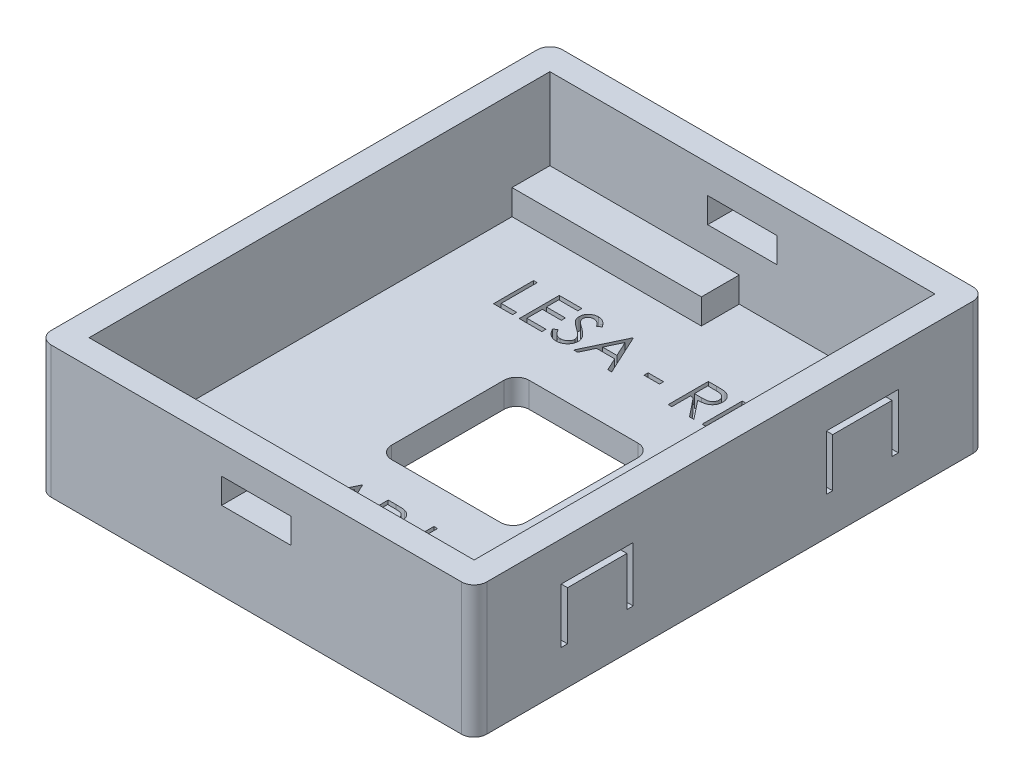
from build123d import *

# Parameters (mm, degrees)
SKETCH1_W           = 34.5
SKETCH1_H           = 40.5
BOSS_EXTRUDE1_DEPTH = 10.45
SKETCH4_W           = 30.5
SKETCH4_H           = 36.5
CUT_EXTRUDE2_DEPTH  = 8.45
SKETCH7_W           = 3
SKETCH7_H           = 3
SKETCH7_W_2         = 2
SKETCH7_W_3         = 15
SKETCH7_W_4         = 10
BOSS_EXTRUDE2_DEPTH = 2
CUT_EXTRUDE3_DEPTH  = 2
CUT_EXTRUDE4_DEPTH  = 2
SKETCH11_W          = 4.7
SKETCH11_H          = 3.85
CUT_EXTRUDE5_DEPTH  = 0.6
FILLET1_R           = 1
FILLET2_R           = 1
FILLET3_R           = 1
FILLET4_R           = 1
SKETCH13_W          = 1.221153846
SKETCH13_H          = 0.325641026
SKETCH13_W_2        = 0.284935898
SKETCH13_H_2        = 3.175
CUT_EXTRUDE6_DEPTH  = 1
SKETCH14_W          = 5.5
SKETCH14_H          = 2
CUT_EXTRUDE7_DEPTH  = 40.5


with BuildPart() as part:
    # Sketch1 → Boss-Extrude1 (new body)
    with BuildSketch(Plane(origin=(0, 0, 0), x_dir=(1, 0, 0), z_dir=(0, 1, 0))):
        Rectangle(SKETCH1_W, SKETCH1_H)
    extrude(amount=BOSS_EXTRUDE1_DEPTH)

    # Sketch4 → Cut-Extrude2 (cut)
    with BuildSketch(Plane(origin=(0, 10.45, 0), x_dir=(1, 0, 0), z_dir=(0, 1, 0))):
        Rectangle(SKETCH4_W, SKETCH4_H)
    extrude(amount=-CUT_EXTRUDE2_DEPTH, mode=Mode.SUBTRACT)

    # Sketch7 → Boss-Extrude2 (add)
    with BuildSketch(Plane(origin=(0, 2, 0), x_dir=(1, 0, 0), z_dir=(0, 1, 0))):
        with Locations((13.75, -16.75)):
            Rectangle(SKETCH7_W, SKETCH7_H)
        with Locations((14.25, 16.75)):
            Rectangle(SKETCH7_W_2, SKETCH7_H)
        with Locations((-7.75, 16.75)):
            Rectangle(SKETCH7_W_3, SKETCH7_H)
        with Locations((-10.25, -16.75)):
            Rectangle(SKETCH7_W_4, SKETCH7_H)
    extrude(amount=BOSS_EXTRUDE2_DEPTH)

    # Sketch8 → Cut-Extrude3 (cut)
    with BuildSketch(Plane(origin=(0, 2, 0), x_dir=(1, 0, 0), z_dir=(0, 1, 0))):
        with BuildLine():
            Line((-3.35, -6.18), (5.27, -6.18))
            ThreePointArc((5.27, -6.18), (5.977106781, -5.887106781), (6.27, -5.18))
            Line((6.27, -5.18), (6.27, 3.71))
            ThreePointArc((6.27, 3.71), (5.977106781, 4.417106781), (5.27, 4.71))
            Line((5.27, 4.71), (-3.35, 4.71))
            ThreePointArc((-3.35, 4.71), (-4.057106781, 4.417106781), (-4.35, 3.71))
            Line((-4.35, 3.71), (-4.35, -5.18))
            ThreePointArc((-4.35, -5.18), (-4.057106781, -5.887106781), (-3.35, -6.18))
        make_face()
    extrude(amount=-CUT_EXTRUDE3_DEPTH, mode=Mode.SUBTRACT)

    # Sketch10 → Cut-Extrude4 (cut)
    with BuildSketch(Plane.ZY.offset(-15.25)):
        Polygon((-13.35, 3), (-13.35, 7.35), (-7.65, 7.35), (-7.65, 3), (-8.15, 3), (-8.15, 6.85), (-12.85, 6.85), (-12.85, 3), align=None)
        Polygon((7.65, 3), (7.65, 7.35), (13.35, 7.35), (13.35, 3), (12.85, 3), (12.85, 6.85), (8.15, 6.85), (8.15, 3), align=None)
    extrude(amount=-CUT_EXTRUDE4_DEPTH, mode=Mode.SUBTRACT)

    # Sketch11 → Cut-Extrude5 (cut)
    with BuildSketch(Plane.ZY.offset(-15.25)):
        with Locations((-10.5, 4.925)):
            Rectangle(SKETCH11_W, SKETCH11_H)
        with Locations((10.5, 4.925)):
            Rectangle(SKETCH11_W, SKETCH11_H)
    extrude(amount=-CUT_EXTRUDE5_DEPTH, mode=Mode.SUBTRACT)

    # Fillet1
    fillet1_edges = [part.edges().sort_by_distance(p)[0] for p in [
        (17.25, 5.225, 20.25),
    ]]
    fillet(fillet1_edges, radius=FILLET1_R)

    # Fillet2
    fillet2_edges = [part.edges().sort_by_distance(p)[0] for p in [
        (17.25, 5.225, -20.25),
    ]]
    fillet(fillet2_edges, radius=FILLET2_R)

    # Fillet3
    fillet3_edges = [part.edges().sort_by_distance(p)[0] for p in [
        (-17.25, 5.225, -20.25),
    ]]
    fillet(fillet3_edges, radius=FILLET3_R)

    # Fillet4
    fillet4_edges = [part.edges().sort_by_distance(p)[0] for p in [
        (-17.25, 5.225, 20.25),
    ]]
    fillet(fillet4_edges, radius=FILLET4_R)

    # Sketch13 → Cut-Extrude6 (cut)
    # profile 1 of 11: a face of its own
    with BuildSketch(Plane(origin=(0, 2, 0), x_dir=(1, 0, 0), z_dir=(0, 1, 0))):
        Polygon((-10.014375407, 11.723911499), (-9.72943951, 11.723911499), (-9.72943951, 8.874552525), (-8.508285664, 8.874552525), (-8.508285664, 8.548911499), (-10.014375407, 8.548911499), align=None)
    # profile 2 of 11: a face of its own
    with BuildSketch(Plane(origin=(0, 2, 0), x_dir=(1, 0, 0), z_dir=(0, 1, 0))):
        Polygon((-7.979118997, 11.723911499), (-6.188093356, 11.723911499), (-6.188093356, 11.398270473), (-7.694183099, 11.398270473), (-7.694183099, 10.421347396), (-6.188093356, 10.421347396), (-6.188093356, 10.095706371), (-7.694183099, 10.095706371), (-7.694183099, 8.874552525), (-6.188093356, 8.874552525), (-6.188093356, 8.548911499), (-7.979118997, 8.548911499), align=None)
    # profile 3 of 11: a face of its own
    with BuildSketch(Plane(origin=(0, 2, 0), x_dir=(1, 0, 0), z_dir=(0, 1, 0))):
        with BuildLine():
            Line((-5.943862587, 9.161396475), (-5.675463148, 9.322308935))
            add(Edge.make_bspline(
                [(-5.675463148, 9.322308935), (-5.650500175, 9.280521957), (-5.602672083, 9.20045972), (-5.522887636, 9.092275641), (-5.440217067, 9.000325684), (-5.354048171, 8.925144762), (-5.264906918, 8.8659547), (-5.172211384, 8.824042676), (-5.076273941, 8.797902469), (-5.010983403, 8.794727391), (-4.978387827, 8.793142268)],
                knots=[0, 0, 0, 0, 1.272034388, 2.437168799, 3.508375237, 4.49857839, 5.41946034, 6.295179144, 7.148887113, 8, 8, 8, 8], degree=3))
            add(Edge.make_bspline(
                [(-4.978387827, 8.793142268), (-4.950550461, 8.793917578), (-4.895362817, 8.795454632), (-4.814117068, 8.810223645), (-4.735212147, 8.83291322), (-4.660274311, 8.865407922), (-4.590337575, 8.904722119), (-4.529008645, 8.952207581), (-4.47598967, 9.005371781), (-4.432619974, 9.06468319), (-4.399345942, 9.128470889), (-4.373771708, 9.193944787), (-4.359579391, 9.262133417), (-4.357441479, 9.308044337), (-4.356362587, 9.331213182)],
                knots=[0, 0, 0, 0, 1.095163259, 2.171163733, 3.241058638, 4.321873601, 5.38011039, 6.391990106, 7.366004449, 8.327778327, 9.272591725, 10.192022065, 11.087607919, 12, 12, 12, 12], degree=3))
            add(Edge.make_bspline(
                [(-4.356362587, 9.331213182), (-4.357699997, 9.357648095), (-4.360418757, 9.411386412), (-4.383398028, 9.490670383), (-4.419546988, 9.5691315), (-4.452895958, 9.617664791), (-4.470209742, 9.642861819)],
                knots=[0, 0, 0, 0, 0.938893495, 1.908633276, 2.914225137, 4, 4, 4, 4], degree=3))
            add(Edge.make_bspline(
                [(-4.470209742, 9.642861819), (-4.484425228, 9.661047152), (-4.514268862, 9.699224984), (-4.565574605, 9.756053162), (-4.625778152, 9.814671299), (-4.692819234, 9.877317729), (-4.769139965, 9.941078802), (-4.852349924, 10.008995025), (-4.944573568, 10.078483599), (-5.009252397, 10.125085855), (-5.042625607, 10.149131851)],
                knots=[0, 0, 0, 0, 0.722233717, 1.516239348, 2.393582979, 3.351407094, 4.387010283, 5.505090956, 6.712668013, 8, 8, 8, 8], degree=3))
            add(Edge.make_bspline(
                [(-5.042625607, 10.149131851), (-5.076030233, 10.172924927), (-5.139897332, 10.218415477), (-5.229213332, 10.285928934), (-5.309082237, 10.347654445), (-5.37914906, 10.404173084), (-5.43938298, 10.455492518), (-5.490258645, 10.501119935), (-5.530480051, 10.542289308), (-5.552846185, 10.568996811), (-5.562888027, 10.580987821)],
                knots=[0, 0, 0, 0, 1.452282411, 2.77665338, 3.964542531, 5.026858415, 5.96415736, 6.766646006, 7.446254459, 8, 8, 8, 8], degree=3))
            add(Edge.make_bspline(
                [(-5.562888027, 10.580987821), (-5.576923836, 10.599675904), (-5.604527138, 10.636428529), (-5.640963443, 10.693873221), (-5.671932541, 10.752677183), (-5.696209799, 10.812998432), (-5.716653369, 10.873990117), (-5.730403778, 10.936448033), (-5.739013831, 11.000091923), (-5.739895561, 11.042921312), (-5.740336946, 11.064361218)],
                knots=[0, 0, 0, 0, 1.068054152, 2.10047183, 3.106115577, 4.101338837, 5.06977816, 6.043150881, 7.020423561, 8, 8, 8, 8], degree=3))
            add(Edge.make_bspline(
                [(-5.740336946, 11.064361218), (-5.739152935, 11.097952514), (-5.73681022, 11.164417115), (-5.716997751, 11.261509368), (-5.685725912, 11.354207046), (-5.641915549, 11.441592421), (-5.585439236, 11.521390132), (-5.520083245, 11.594518081), (-5.442239968, 11.655993866), (-5.356830088, 11.709707662), (-5.263343237, 11.751750037), (-5.16538006, 11.78346464), (-5.062784859, 11.801434467), (-4.993294872, 11.804013261), (-4.958035263, 11.805321755)],
                knots=[0, 0, 0, 0, 1.005424448, 1.989358655, 2.955360095, 3.929531133, 4.905563448, 5.876582895, 6.856512386, 7.866279853, 8.892233794, 9.918561126, 10.94386622, 12, 12, 12, 12], degree=3))
            add(Edge.make_bspline(
                [(-4.958035263, 11.805321755), (-4.920620972, 11.804031298), (-4.846215889, 11.80146499), (-4.736769814, 11.779151515), (-4.63139545, 11.742230191), (-4.54662906, 11.70033048), (-4.480287198, 11.658482696), (-4.429693362, 11.620364712), (-4.37842396, 11.576481578), (-4.326065439, 11.526716405), (-4.273504983, 11.470612566), (-4.21996228, 11.408554298), (-4.165312122, 11.340920851), (-4.130155021, 11.292638626), (-4.112131817, 11.267886859)],
                knots=[0, 0, 0, 0, 1.286793592, 2.559021753, 3.825965368, 5.121522368, 5.803751409, 6.523245864, 7.299691795, 8.125521123, 9.008227632, 9.944561021, 10.946284179, 12, 12, 12, 12], degree=3))
            Line((-4.112131817, 11.267886859), (-4.369718957, 11.072629448))
            add(Edge.make_bspline(
                [(-4.369718957, 11.072629448), (-4.385272767, 11.092667045), (-4.415225769, 11.131254774), (-4.460700375, 11.185294467), (-4.503561648, 11.234657988), (-4.545789511, 11.277534211), (-4.585153734, 11.316271146), (-4.623359908, 11.349436069), (-4.659858212, 11.37735393), (-4.705865695, 11.407147731), (-4.763666768, 11.436681131), (-4.836224169, 11.46167208), (-4.912048861, 11.476689886), (-4.96369217, 11.47867552), (-4.989836144, 11.47968073)],
                knots=[0, 0, 0, 0, 1.181633172, 2.275549214, 3.290209073, 4.226197932, 5.078386478, 5.862611352, 6.581680152, 7.217281963, 8.414376989, 9.595101626, 10.782541182, 12, 12, 12, 12], degree=3))
            add(Edge.make_bspline(
                [(-4.989836144, 11.47968073), (-5.022635275, 11.478581545), (-5.08588531, 11.47646187), (-5.175683595, 11.453311598), (-5.256504513, 11.41686091), (-5.325948626, 11.36577518), (-5.383767169, 11.305249708), (-5.425591407, 11.235600318), (-5.45076477, 11.158690567), (-5.45383661, 11.105040636), (-5.455401048, 11.077717589)],
                knots=[0, 0, 0, 0, 1.14458467, 2.207223713, 3.21896685, 4.227309161, 5.202851033, 6.127160689, 7.046193047, 8, 8, 8, 8], degree=3))
            add(Edge.make_bspline(
                [(-5.455401048, 11.077717589), (-5.455044426, 11.060707319), (-5.454330599, 11.026658964), (-5.44437489, 10.976356603), (-5.431584784, 10.926181316), (-5.411316825, 10.876358687), (-5.383335728, 10.826017376), (-5.346591747, 10.774290514), (-5.300315386, 10.720722178), (-5.264866953, 10.685881204), (-5.246151249, 10.667486218)],
                knots=[0, 0, 0, 0, 0.858281714, 1.717966888, 2.583508476, 3.4729293, 4.427298488, 5.488583878, 6.674047936, 8, 8, 8, 8], degree=3))
            add(Edge.make_bspline(
                [(-5.246151249, 10.667486218), (-5.239201289, 10.661284059), (-5.222689777, 10.646549149), (-5.192503759, 10.622426151), (-5.152641363, 10.592669351), (-5.104143509, 10.555850857), (-5.046115974, 10.513141245), (-4.978552376, 10.465086611), (-4.902205843, 10.410126944), (-4.848029534, 10.371702604), (-4.81938342, 10.351385457)],
                knots=[0, 0, 0, 0, 0.420754252, 0.999615792, 1.744751191, 2.668019286, 3.750313428, 4.999500688, 6.413464383, 8, 8, 8, 8], degree=3))
            add(Edge.make_bspline(
                [(-4.81938342, 10.351385457), (-4.78492477, 10.326310795), (-4.71820037, 10.277757188), (-4.623260994, 10.204808678), (-4.537178754, 10.133463917), (-4.459651419, 10.064178516), (-4.389913081, 9.997478032), (-4.328737434, 9.932560004), (-4.275501139, 9.86988952), (-4.218188562, 9.789541541), (-4.159625397, 9.690861557), (-4.10933203, 9.569959155), (-4.077619814, 9.448586778), (-4.073472797, 9.367010291), (-4.071426689, 9.326761058)],
                knots=[0, 0, 0, 0, 1.163667725, 2.253281268, 3.268753668, 4.215851969, 5.092017293, 5.902905408, 6.650798638, 7.335211899, 8.59617414, 9.77448103, 10.901945474, 12, 12, 12, 12], degree=3))
            add(Edge.make_bspline(
                [(-4.071426689, 9.326761058), (-4.072022807, 9.298296398), (-4.073203467, 9.241919843), (-4.086775154, 9.159138452), (-4.106659421, 9.078737592), (-4.136628912, 9.001711083), (-4.173207777, 8.926649762), (-4.219622873, 8.855522595), (-4.273423416, 8.786755362), (-4.33513976, 8.722181767), (-4.402672828, 8.662903432), (-4.47405018, 8.610172069), (-4.549388642, 8.566204375), (-4.628279515, 8.530326112), (-4.71074092, 8.502264992), (-4.796745124, 8.481933318), (-4.886433895, 8.469454923), (-4.947394332, 8.468159739), (-4.978387827, 8.467501242)],
                knots=[0, 0, 0, 0, 0.983748083, 1.948392443, 2.894712957, 3.844097841, 4.80183111, 5.778335162, 6.776009319, 7.81870978, 8.863265674, 9.881300176, 10.883814829, 11.87499822, 12.874611388, 13.892143829, 14.928324115, 16, 16, 16, 16], degree=3))
            add(Edge.make_bspline(
                [(-4.978387827, 8.467501242), (-5.00236846, 8.467964957), (-5.050027713, 8.468886547), (-5.120521315, 8.477033851), (-5.189590799, 8.488561009), (-5.256369469, 8.506861773), (-5.321717693, 8.529065888), (-5.385351256, 8.556405661), (-5.447300997, 8.589169122), (-5.50791409, 8.626629609), (-5.567036377, 8.670224848), (-5.624113323, 8.721000806), (-5.681017656, 8.777557085), (-5.736069794, 8.841429525), (-5.790383289, 8.911586215), (-5.842887275, 8.988683545), (-5.894668547, 9.072301573), (-5.927158293, 9.131143472), (-5.943862587, 9.161396475)],
                knots=[0, 0, 0, 0, 0.915332311, 1.819136955, 2.706846663, 3.586547465, 4.459518054, 5.340707479, 6.227863349, 7.133153174, 8.059268498, 9.028702269, 10.047606654, 11.120612155, 12.245963614, 13.433783089, 14.680604001, 16, 16, 16, 16], degree=3))
        make_face()
    # profile 4 of 11: a face of its own
    with BuildSketch(Plane(origin=(0, 2, 0), x_dir=(1, 0, 0), z_dir=(0, 1, 0))):
        Polygon((-2.117580535, 11.723911499), (-0.65219592, 8.548911499), (-0.961936505, 8.548911499), (-1.431317515, 9.566539704), (-2.870625407, 9.566539704), (-3.353362787, 8.548911499), (-3.664375407, 8.548911499), (-2.158285664, 11.723911499), align=None)
        Polygon((-2.141113188, 11.105066347), (-2.716073124, 9.89218073), (-1.581417675, 9.89218073), align=None, mode=Mode.SUBTRACT)
    # profile 5 of 11: a face of its own
    with BuildSketch(Plane(origin=(0, 2, 0), x_dir=(1, 0, 0), z_dir=(0, 1, 0))):
        with Locations((1.464470747, 9.770065345)):
            Rectangle(SKETCH13_W, SKETCH13_H)
    # profile 6 of 11: a face of its own
    with BuildSketch(Plane(origin=(0, 2, 0), x_dir=(1, 0, 0), z_dir=(0, 1, 0))):
        with BuildLine():
            Line((3.825368183, 11.723911499), (4.460749793, 11.723911499))
            add(Edge.make_bspline(
                [(4.460749793, 11.723911499), (4.503150674, 11.72377036), (4.584565062, 11.723499358), (4.701199386, 11.721988273), (4.807178253, 11.717657251), (4.90244625, 11.713930178), (4.98700163, 11.707133917), (5.061103672, 11.700638187), (5.124411083, 11.692134938), (5.162734105, 11.684237876), (5.180085731, 11.6806623)],
                knots=[0, 0, 0, 0, 1.410062039, 2.707475311, 3.878576406, 4.937260626, 5.877586885, 6.699081471, 7.410979367, 8, 8, 8, 8], degree=3))
            add(Edge.make_bspline(
                [(5.180085731, 11.6806623), (5.203314597, 11.67492302), (5.249276794, 11.663566895), (5.315452926, 11.639564257), (5.378512348, 11.611787883), (5.438193117, 11.579163651), (5.494196299, 11.541449386), (5.547099339, 11.499296161), (5.597142295, 11.452934624), (5.642301345, 11.401195875), (5.68488177, 11.346915613), (5.72079431, 11.288220062), (5.751751902, 11.226841391), (5.776399443, 11.162155376), (5.79624589, 11.09478934), (5.810239693, 11.024133075), (5.818631842, 10.950508476), (5.819486239, 10.900290944), (5.819919465, 10.874827965)],
                knots=[0, 0, 0, 0, 1.027469482, 2.033020251, 3.019912614, 3.986113645, 4.951240523, 5.91722682, 6.890402269, 7.87763091, 8.8651537, 9.85103654, 10.82876324, 11.815024772, 12.821070561, 13.842952187, 14.906261191, 16, 16, 16, 16], degree=3))
            add(Edge.make_bspline(
                [(5.819919465, 10.874827965), (5.818586873, 10.832523263), (5.815986643, 10.749975832), (5.791743156, 10.630177747), (5.752031599, 10.51842744), (5.697309758, 10.414865619), (5.62762352, 10.321510962), (5.543871745, 10.239513906), (5.446007711, 10.170897699), (5.354903975, 10.123315512), (5.274427522, 10.092841945), (5.208175874, 10.071400391), (5.135906545, 10.05483418), (5.058311963, 10.039993203), (4.975069218, 10.028788452), (4.886377825, 10.020581898), (4.79217453, 10.015452868), (4.727459803, 10.01468905), (4.694168263, 10.014296114)],
                knots=[0, 0, 0, 0, 1.260483769, 2.459530307, 3.627416485, 4.787058657, 5.939039949, 7.08810263, 8.267026773, 9.491475466, 10.141966685, 10.831826277, 11.566392101, 12.351337768, 13.187381173, 14.07005841, 15.007169909, 16, 16, 16, 16], degree=3))
            Line((4.694168263, 10.014296114), (5.860624593, 8.548911499))
            Line((5.860624593, 8.548911499), (5.508270827, 8.548911499))
            Line((5.508270827, 8.548911499), (4.341814497, 10.014296114))
            Line((4.341814497, 10.014296114), (4.11030408, 10.014296114))
            Line((4.11030408, 10.014296114), (4.11030408, 8.548911499))
            Line((4.11030408, 8.548911499), (3.825368183, 8.548911499))
            Line((3.825368183, 8.548911499), (3.825368183, 11.723911499))
        make_face()
        with BuildLine():
            Line((4.11030408, 11.398270473), (4.11030408, 10.33993714))
            Line((4.11030408, 10.33993714), (4.691624192, 10.335485016))
            add(Edge.make_bspline(
                [(4.691624192, 10.335485016), (4.718765942, 10.335473009), (4.771374383, 10.335449735), (4.847484272, 10.339072661), (4.918350373, 10.343194099), (4.983701627, 10.349498148), (5.043567227, 10.357622585), (5.097917252, 10.367785292), (5.146840421, 10.379625377), (5.20389838, 10.397951138), (5.267612948, 10.426985169), (5.336856487, 10.469226728), (5.395822893, 10.522357286), (5.44564124, 10.583111779), (5.485672938, 10.649910376), (5.513896016, 10.721952368), (5.531805232, 10.797419032), (5.533917555, 10.849287744), (5.534983567, 10.875463983)],
                knots=[0, 0, 0, 0, 1.146690395, 2.22261258, 3.21895312, 4.145990853, 4.996080663, 5.770904154, 6.481378293, 7.121626537, 8.300444488, 9.431385265, 10.535395872, 11.636531494, 12.74115979, 13.810798291, 14.895190096, 16, 16, 16, 16], degree=3))
            add(Edge.make_bspline(
                [(5.534983567, 10.875463983), (5.533893072, 10.900996946), (5.531732107, 10.951593963), (5.514089296, 11.025667538), (5.484253929, 11.095578272), (5.444047327, 11.161041769), (5.395062379, 11.220464829), (5.337624078, 11.271307604), (5.273302936, 11.313262475), (5.213185492, 11.340072521), (5.159451599, 11.356509816), (5.112797551, 11.368076943), (5.060082139, 11.37737014), (5.001049401, 11.384816024), (4.935951351, 11.391215866), (4.864458831, 11.395526408), (4.787046181, 11.398078985), (4.733391465, 11.398205158), (4.70561658, 11.398270473)],
                knots=[0, 0, 0, 0, 1.101028733, 2.181837193, 3.264309656, 4.369019818, 5.486613113, 6.575447106, 7.666700264, 8.788928104, 9.402425223, 10.0903467, 10.862060571, 11.710948788, 12.657782767, 13.684531032, 14.801375019, 16, 16, 16, 16], degree=3))
            Line((4.70561658, 11.398270473), (4.11030408, 11.398270473))
        make_face(mode=Mode.SUBTRACT)
    # profile 7 of 11: a face of its own
    with BuildSketch(Plane(origin=(0, 2, 0), x_dir=(1, 0, 0), z_dir=(0, 1, 0))):
        with BuildLine():
            Line((6.511906644, 11.723911499), (7.134567902, 11.723911499))
            add(Edge.make_bspline(
                [(7.134567902, 11.723911499), (7.177394938, 11.723864422), (7.259453442, 11.723774219), (7.377123528, 11.721039414), (7.483993785, 11.717386629), (7.579833773, 11.712323055), (7.664938376, 11.706339005), (7.738922498, 11.697946084), (7.802367667, 11.689182815), (7.840382803, 11.680273397), (7.857719945, 11.676210177)],
                knots=[0, 0, 0, 0, 1.415646017, 2.712440637, 3.8905458, 4.950247383, 5.884950622, 6.709939814, 7.411656543, 8, 8, 8, 8], degree=3))
            add(Edge.make_bspline(
                [(7.857719945, 11.676210177), (7.879666937, 11.670203122), (7.923043766, 11.658330562), (7.985546855, 11.63455097), (8.045013558, 11.606355006), (8.1016479, 11.574220432), (8.154753933, 11.536768527), (8.205123984, 11.49551746), (8.252313538, 11.449514822), (8.296057229, 11.39927658), (8.336229867, 11.345646104), (8.370818936, 11.287822795), (8.399781492, 11.22677997), (8.424622031, 11.162560088), (8.442500415, 11.094623866), (8.455968674, 11.023443348), (8.46451725, 10.949026165), (8.465336003, 10.898171856), (8.465752798, 10.872283895)],
                knots=[0, 0, 0, 0, 0.999701418, 1.975846123, 2.934577507, 3.890451536, 4.834027766, 5.787354733, 6.749476667, 7.726910423, 8.712836071, 9.690891519, 10.682875813, 11.679750201, 12.712814741, 13.765529915, 14.8625177, 16, 16, 16, 16], degree=3))
            add(Edge.make_bspline(
                [(8.465752798, 10.872283895), (8.465370506, 10.84617834), (8.464622525, 10.795101059), (8.45564518, 10.720377173), (8.443552792, 10.648968347), (8.424959037, 10.581032917), (8.400606177, 10.516974326), (8.372038386, 10.455813637), (8.337581898, 10.398591363), (8.297989802, 10.345099763), (8.25394657, 10.295288628), (8.205638548, 10.249518922), (8.153260761, 10.208058558), (8.096979669, 10.170814589), (8.036246592, 10.138650678), (7.971982639, 10.109842266), (7.903629228, 10.085647804), (7.856328519, 10.072920534), (7.83227924, 10.06644956)],
                knots=[0, 0, 0, 0, 1.121902311, 2.195077645, 3.232258892, 4.234102512, 5.217864754, 6.176164875, 7.132989551, 8.084763148, 9.034132444, 9.988522005, 10.94243251, 11.903244335, 12.886203696, 13.894208494, 14.929344452, 16, 16, 16, 16], degree=3))
            add(Edge.make_bspline(
                [(7.83227924, 10.06644956), (7.812388016, 10.06221957), (7.768795241, 10.052949301), (7.697001486, 10.042600201), (7.613412457, 10.033766806), (7.518142246, 10.027143631), (7.411276368, 10.021473654), (7.292757013, 10.016966883), (7.162351529, 10.014490516), (7.071391186, 10.014362796), (7.023900835, 10.014296114)],
                knots=[0, 0, 0, 0, 0.601384939, 1.31797006, 2.144135048, 3.087295005, 4.142315834, 5.309527816, 6.595305764, 8, 8, 8, 8], degree=3))
            Line((7.023900835, 10.014296114), (6.796842542, 10.014296114))
            Line((6.796842542, 10.014296114), (6.796842542, 8.548911499))
            Line((6.796842542, 8.548911499), (6.511906644, 8.548911499))
            Line((6.511906644, 8.548911499), (6.511906644, 11.723911499))
        make_face()
        with BuildLine():
            Line((6.796842542, 11.398270473), (6.796842542, 10.33993714))
            Line((6.796842542, 10.33993714), (7.352721949, 10.332940946))
            add(Edge.make_bspline(
                [(7.352721949, 10.332940946), (7.379863596, 10.332926918), (7.432259986, 10.332899838), (7.507948559, 10.336515005), (7.578169842, 10.340688345), (7.642708135, 10.34679879), (7.701592533, 10.355435931), (7.75492122, 10.36415515), (7.802280683, 10.376769301), (7.857706388, 10.393753799), (7.91946771, 10.422721243), (7.986657558, 10.464767215), (8.043599447, 10.518361858), (8.092873902, 10.57862139), (8.131977091, 10.645658458), (8.160602884, 10.717385279), (8.177422362, 10.793066257), (8.179677695, 10.844853354), (8.180816901, 10.871011859)],
                knots=[0, 0, 0, 0, 1.160613943, 2.240541288, 3.23993089, 4.169200891, 5.011653406, 5.7853311, 6.478053781, 7.106038997, 8.262395093, 9.384106736, 10.481365981, 11.59014053, 12.70357646, 13.786202915, 14.881775077, 16, 16, 16, 16], degree=3))
            add(Edge.make_bspline(
                [(8.180816901, 10.871011859), (8.1796715, 10.896537511), (8.177394585, 10.947279347), (8.160471052, 11.021645794), (8.132032746, 11.092616754), (8.092611406, 11.158813768), (8.044767667, 11.218856468), (7.989160406, 11.271014576), (7.925920519, 11.312944264), (7.867093909, 11.340007312), (7.814841405, 11.356531169), (7.76945527, 11.36809256), (7.718210158, 11.377323289), (7.661089386, 11.384797695), (7.598535687, 11.391196192), (7.530011644, 11.395537757), (7.455776839, 11.398079078), (7.404241536, 11.39820513), (7.377526636, 11.398270473)],
                knots=[0, 0, 0, 0, 1.120700087, 2.227813068, 3.331159281, 4.466773991, 5.599788987, 6.693661531, 7.80175334, 8.91857717, 9.525282508, 10.207424825, 10.974604443, 11.810962634, 12.737642355, 13.736264703, 14.826523623, 16, 16, 16, 16], degree=3))
            Line((7.377526636, 11.398270473), (6.796842542, 11.398270473))
        make_face(mode=Mode.SUBTRACT)
    # profile 8 of 11: a face of its own
    with BuildSketch(Plane(origin=(0, 2, 0), x_dir=(1, 0, 0), z_dir=(0, 1, 0))):
        with Locations((9.259502798, 10.136411499)):
            Rectangle(SKETCH13_W_2, SKETCH13_H_2)
    # profile 9 of 11: a face of its own
    with BuildSketch(Plane(origin=(0, 2, 0), x_dir=(1, 0, 0), z_dir=(0, 1, 0))):
        Polygon((-2.752227276, -9.08926694), (-1.286842661, -12.26426694), (-1.596583246, -12.26426694), (-2.065964255, -11.246638735), (-3.505272148, -11.246638735), (-3.988009528, -12.26426694), (-4.299022148, -12.26426694), (-2.792932404, -9.08926694), align=None)
        Polygon((-2.775759928, -9.708112092), (-3.350719864, -10.920997709), (-2.216064416, -10.920997709), align=None, mode=Mode.SUBTRACT)
    # profile 10 of 11: a face of its own
    with BuildSketch(Plane(origin=(0, 2, 0), x_dir=(1, 0, 0), z_dir=(0, 1, 0))):
        with BuildLine():
            Line((-0.716970866, -9.08926694), (-0.094309608, -9.08926694))
            add(Edge.make_bspline(
                [(-0.094309608, -9.08926694), (-0.051482572, -9.089314017), (0.030575932, -9.089404219), (0.148246018, -9.092139025), (0.255116275, -9.09579181), (0.350956263, -9.100855384), (0.436060866, -9.106839434), (0.510044988, -9.115232355), (0.573490157, -9.123995623), (0.611505293, -9.132905042), (0.628842435, -9.136968262)],
                knots=[0, 0, 0, 0, 1.415646017, 2.712440637, 3.8905458, 4.950247383, 5.884950622, 6.709939814, 7.411656543, 8, 8, 8, 8], degree=3))
            add(Edge.make_bspline(
                [(0.628842435, -9.136968262), (0.650789427, -9.142975316), (0.694166256, -9.154847877), (0.756669345, -9.178627469), (0.816136048, -9.206823433), (0.87277039, -9.238958007), (0.925876423, -9.276409912), (0.976246474, -9.317660979), (1.023436028, -9.363663616), (1.067179719, -9.413901859), (1.107352357, -9.467532335), (1.141941426, -9.525355644), (1.170903982, -9.586398469), (1.195744521, -9.650618351), (1.213622905, -9.718554573), (1.227091164, -9.789735091), (1.23563974, -9.864152274), (1.236458493, -9.915006582), (1.236875288, -9.940894544)],
                knots=[0, 0, 0, 0, 0.999701418, 1.975846123, 2.934577507, 3.890451536, 4.834027766, 5.787354733, 6.749476667, 7.726910423, 8.712836071, 9.690891519, 10.682875813, 11.679750201, 12.712814741, 13.765529915, 14.8625177, 16, 16, 16, 16], degree=3))
            add(Edge.make_bspline(
                [(1.236875288, -9.940894544), (1.236492996, -9.967000099), (1.235745015, -10.01807738), (1.22676767, -10.092801266), (1.214675282, -10.164210091), (1.196081527, -10.232145521), (1.171728667, -10.296204113), (1.143160876, -10.357364802), (1.108704388, -10.414587076), (1.069112292, -10.468078676), (1.02506906, -10.51788981), (0.976761038, -10.563659517), (0.924383251, -10.605119881), (0.868102159, -10.64236385), (0.807369082, -10.67452776), (0.743105129, -10.703336173), (0.674751718, -10.727530635), (0.627451009, -10.740257905), (0.60340173, -10.746728879)],
                knots=[0, 0, 0, 0, 1.121902311, 2.195077645, 3.232258892, 4.234102512, 5.217864754, 6.176164875, 7.132989551, 8.084763148, 9.034132444, 9.988522005, 10.94243251, 11.903244335, 12.886203696, 13.894208494, 14.929344452, 16, 16, 16, 16], degree=3))
            add(Edge.make_bspline(
                [(0.60340173, -10.746728879), (0.583510506, -10.750958869), (0.539917731, -10.760229138), (0.468123976, -10.770578238), (0.384534947, -10.779411633), (0.289264736, -10.786034808), (0.182398858, -10.791704785), (0.063879503, -10.796211556), (-0.066525981, -10.798687923), (-0.157486324, -10.798815642), (-0.204976675, -10.798882325)],
                knots=[0, 0, 0, 0, 0.601384939, 1.31797006, 2.144135048, 3.087295005, 4.142315834, 5.309527816, 6.595305764, 8, 8, 8, 8], degree=3))
            Line((-0.204976675, -10.798882325), (-0.432034968, -10.798882325))
            Line((-0.432034968, -10.798882325), (-0.432034968, -12.26426694))
            Line((-0.432034968, -12.26426694), (-0.716970866, -12.26426694))
            Line((-0.716970866, -12.26426694), (-0.716970866, -9.08926694))
        make_face()
        with BuildLine():
            Line((-0.432034968, -9.414907966), (-0.432034968, -10.473241299))
            Line((-0.432034968, -10.473241299), (0.123844439, -10.480237493))
            add(Edge.make_bspline(
                [(0.123844439, -10.480237493), (0.150986086, -10.48025152), (0.203382476, -10.480278601), (0.279071049, -10.476663434), (0.349292332, -10.472490093), (0.413830625, -10.466379648), (0.472715023, -10.457742508), (0.52604371, -10.449023288), (0.573403173, -10.436409138), (0.628828878, -10.41942464), (0.6905902, -10.390457195), (0.757780048, -10.348411224), (0.814721937, -10.294816581), (0.863996392, -10.234557048), (0.903099581, -10.167519981), (0.931725374, -10.09579316), (0.948544852, -10.020112182), (0.950800185, -9.968325085), (0.951939391, -9.942166579)],
                knots=[0, 0, 0, 0, 1.160613943, 2.240541288, 3.23993089, 4.169200891, 5.011653406, 5.7853311, 6.478053781, 7.106038997, 8.262395093, 9.384106736, 10.481365981, 11.59014053, 12.70357646, 13.786202915, 14.881775077, 16, 16, 16, 16], degree=3))
            add(Edge.make_bspline(
                [(0.951939391, -9.942166579), (0.95079399, -9.916640928), (0.948517075, -9.865899092), (0.931593542, -9.791532645), (0.903155236, -9.720561684), (0.863733896, -9.654364671), (0.815890157, -9.59432197), (0.760282896, -9.542163862), (0.697043009, -9.500234175), (0.638216399, -9.473171127), (0.585963895, -9.45664727), (0.54057776, -9.445085879), (0.489332648, -9.43585515), (0.432211876, -9.428380744), (0.369658177, -9.421982247), (0.301134134, -9.417640682), (0.226899329, -9.415099361), (0.175364026, -9.414973309), (0.148649126, -9.414907966)],
                knots=[0, 0, 0, 0, 1.120700087, 2.227813068, 3.331159281, 4.466773991, 5.599788987, 6.693661531, 7.80175334, 8.91857717, 9.525282508, 10.207424825, 10.974604443, 11.810962634, 12.737642355, 13.736264703, 14.826523623, 16, 16, 16, 16], degree=3))
            Line((0.148649126, -9.414907966), (-0.432034968, -9.414907966))
        make_face(mode=Mode.SUBTRACT)
    # profile 11 of 11: a face of its own
    with BuildSketch(Plane(origin=(0, 2, 0), x_dir=(1, 0, 0), z_dir=(0, 1, 0))):
        with BuildLine():
            Line((2.905785544, -9.08926694), (3.190721442, -9.08926694))
            Line((3.190721442, -9.08926694), (3.190721442, -11.233282365))
            add(Edge.make_bspline(
                [(3.190721442, -11.233282365), (3.190436673, -11.272929198), (3.189889881, -11.349055957), (3.186883238, -11.458705848), (3.181319297, -11.558827827), (3.173213964, -11.649649562), (3.16240061, -11.730886522), (3.150026249, -11.803166411), (3.135046781, -11.86588598), (3.112489344, -11.936312339), (3.075501548, -12.013549933), (3.019832878, -12.096966391), (2.950678841, -12.169930985), (2.870577189, -12.233297386), (2.778827832, -12.283786445), (2.677320162, -12.3200315), (2.566679043, -12.342139348), (2.489935472, -12.344474248), (2.450396923, -12.345677196)],
                knots=[0, 0, 0, 0, 1.237770943, 2.376671248, 3.424123796, 4.367912054, 5.222547132, 5.982086412, 6.656319012, 7.234008312, 8.288027371, 9.317870876, 10.352700517, 11.413286737, 12.494591526, 13.606319346, 14.766767577, 16, 16, 16, 16], degree=3))
            add(Edge.make_bspline(
                [(2.450396923, -12.345677196), (2.41959184, -12.344696929), (2.357609975, -12.342724568), (2.265361975, -12.326648442), (2.173375897, -12.301868889), (2.081163511, -12.26558082), (1.986902985, -12.21622717), (1.889317685, -12.151652372), (1.787152361, -12.07197663), (1.719857523, -12.011163818), (1.684631698, -11.979331042)],
                knots=[0, 0, 0, 0, 0.848567217, 1.707373443, 2.573483905, 3.470863513, 4.432650262, 5.500696352, 6.691726801, 8, 8, 8, 8], degree=3))
            Line((1.684631698, -11.979331042), (1.852540352, -11.735100273))
            add(Edge.make_bspline(
                [(1.852540352, -11.735100273), (1.891277782, -11.761813268), (1.964419102, -11.812250886), (2.071919559, -11.877135731), (2.167166976, -11.932766417), (2.229472221, -11.961116699), (2.258319599, -11.974242901)],
                knots=[0, 0, 0, 0, 1.196737151, 2.259595785, 3.194191475, 4, 4, 4, 4], degree=3))
            add(Edge.make_bspline(
                [(2.258319599, -11.974242901), (2.275813224, -11.981100409), (2.310122119, -11.994549509), (2.362577727, -12.009559002), (2.41473394, -12.01776176), (2.449312133, -12.019286969), (2.466297363, -12.020036171)],
                knots=[0, 0, 0, 0, 1.051806502, 2.062826769, 3.048436908, 4, 4, 4, 4], degree=3))
            add(Edge.make_bspline(
                [(2.466297363, -12.020036171), (2.488234607, -12.019108404), (2.53159645, -12.017274551), (2.594610216, -12.001082709), (2.654897144, -11.976368143), (2.710296048, -11.940181041), (2.761354934, -11.897153966), (2.803485212, -11.845123873), (2.838607284, -11.787460445), (2.859743434, -11.73287634), (2.873209763, -11.683095397), (2.881756525, -11.637345338), (2.889230167, -11.583858854), (2.89574486, -11.522572101), (2.899558915, -11.453362378), (2.903838156, -11.376432906), (2.905385071, -11.291589728), (2.90564798, -11.232434079), (2.905785544, -11.201481483)],
                knots=[0, 0, 0, 0, 0.997221856, 1.971139923, 2.944579524, 3.951425367, 4.971190333, 5.972282193, 6.985401279, 8.033996657, 8.624075553, 9.332086008, 10.151144245, 11.082816738, 12.137127781, 13.306538797, 14.590673636, 16, 16, 16, 16], degree=3))
            Line((2.905785544, -11.201481483), (2.905785544, -9.08926694))
        make_face()
    extrude(amount=-CUT_EXTRUDE6_DEPTH, mode=Mode.SUBTRACT)

    # Sketch14 → Cut-Extrude7 (cut)
    with BuildSketch(Plane(origin=(0, 0, -20.25), x_dir=(-1, 0, 0), z_dir=(0, 0, -1))):
        with Locations((0, 7.2)):
            Rectangle(SKETCH14_W, SKETCH14_H)
    extrude(amount=-CUT_EXTRUDE7_DEPTH, mode=Mode.SUBTRACT)


solid = part.part
